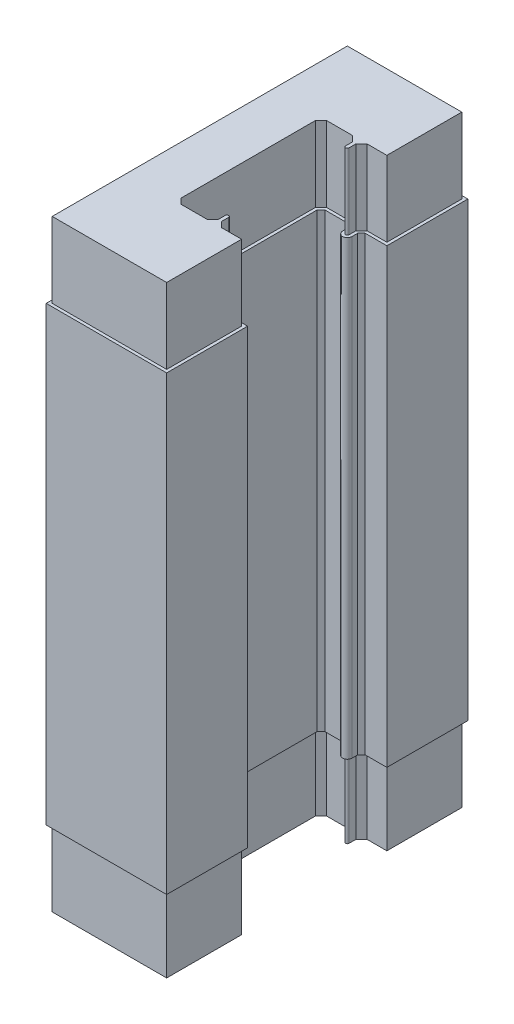
from build123d import *

# Parameters (mm, degrees)
BOSS_EXTRUDE1_DEPTH = 40
CUT_EXTRUDE6_START  = -5
CUT_EXTRUDE6_DEPTH  = 5
CUT_EXTRUDE7_DEPTH  = 5
SKETCH10_R          = 1.5
CUT_EXTRUDE8_DEPTH  = 3
CUT_EXTRUDE4_START  = -5
CUT_EXTRUDE4_DEPTH  = 5
CUT_EXTRUDE5_DEPTH  = 5


with BuildPart() as part:
    # Sketch1 → Boss-Extrude1 (new body)
    with BuildSketch(Plane(origin=(0, 0, 0), x_dir=(1, 0, 0), z_dir=(0, 1, 0))):
        with BuildLine():
            Line((-3.897731109, -10.925164292), (4.102268891, -10.925164292))
            Line((4.102268891, -10.925164292), (4.102268891, -5.550166604))
            Line((4.102268891, -5.550166604), (3.383518531, -5.550166604))
            Line((3.383518531, -5.550166604), (2.664768172, -5.550166604))
            Line((2.664768172, -5.550166604), (2.414768047, -5.300166479))
            Line((2.414768047, -5.300166479), (2.414768047, -4.925166292))
            ThreePointArc((2.414768047, -4.925166292), (2.32323887, -4.704195312), (2.102267891, -4.612666136))
            ThreePointArc((2.102267891, -4.612666136), (1.881296911, -4.704195312), (1.789767734, -4.925166292))
            Line((1.789767734, -4.925166292), (1.789767734, -5.300166479))
            Line((1.789767734, -5.300166479), (1.539767609, -5.550166604))
            Line((1.539767609, -5.550166604), (-0.022733172, -5.550166604))
            Line((-0.022733172, -5.550166604), (-0.272733297, -5.300166479))
            Line((-0.272733297, -5.300166479), (-0.272733297, 3.449837896))
            Line((-0.272733297, 3.449837896), (-0.022733172, 3.699838021))
            Line((-0.022733172, 3.699838021), (1.539767609, 3.699838021))
            Line((1.539767609, 3.699838021), (1.789767734, 3.449837896))
            Line((1.789767734, 3.449837896), (1.789767734, 3.074837708))
            ThreePointArc((1.789767734, 3.074837708), (1.881296911, 2.853866728), (2.102267891, 2.762337552))
            ThreePointArc((2.102267891, 2.762337552), (2.32323887, 2.853866728), (2.414768047, 3.074837708))
            Line((2.414768047, 3.074837708), (2.414768047, 3.449837896))
            Line((2.414768047, 3.449837896), (2.664768172, 3.699838021))
            Line((2.664768172, 3.699838021), (3.383518531, 3.699838021))
            Line((3.383518531, 3.699838021), (4.102268891, 3.699838021))
            Line((4.102268891, 3.699838021), (4.102268891, 9.074835708))
            Line((4.102268891, 9.074835708), (-3.897731109, 9.074835708))
            Line((-3.897731109, 9.074835708), (-3.897731109, -10.925164292))
        make_face()
    extrude(amount=BOSS_EXTRUDE1_DEPTH)

    # Sketch8 → Cut-Extrude6 (cut)
    with BuildSketch(Plane(origin=(0, 40, 0), x_dir=(1, 0, 0), z_dir=(0, 1, 0)).offset(CUT_EXTRUDE6_START)):
        with BuildLine():
            Line((2.414768047, 3.074837708), (2.414768047, 3.449837896))
            Line((2.414768047, 3.449837896), (2.664768172, 3.699838021))
            Line((2.664768172, 3.699838021), (4.102268891, 3.699838021))
            Line((4.102268891, 3.699838021), (4.102268891, 9.074835708))
            Line((4.102268891, 9.074835708), (-3.897731109, 9.074835708))
            Line((-3.897731109, 9.074835708), (-3.897731109, -10.925164292))
            Line((-3.897731109, -10.925164292), (4.102268891, -10.925164292))
            Line((4.102268891, -10.925164292), (4.102268891, -5.550166604))
            Line((4.102268891, -5.550166604), (2.664768172, -5.550166604))
            Line((2.664768172, -5.550166604), (2.414768047, -5.300166479))
            Line((2.414768047, -5.300166479), (2.414768047, -4.925166292))
            ThreePointArc((2.414768047, -4.925166292), (2.102267891, -4.612666136), (1.789767734, -4.925166292))
            Line((1.789767734, -4.925166292), (1.789767734, -5.300166479))
            Line((1.789767734, -5.300166479), (1.539767609, -5.550166604))
            Line((1.539767609, -5.550166604), (-0.022733172, -5.550166604))
            Line((-0.022733172, -5.550166604), (-0.272733297, -5.300166479))
            Line((-0.272733297, -5.300166479), (-0.272733297, 3.449837896))
            Line((-0.272733297, 3.449837896), (-0.022733172, 3.699838021))
            Line((-0.022733172, 3.699838021), (1.539767609, 3.699838021))
            Line((1.539767609, 3.699838021), (1.789767734, 3.449837896))
            Line((1.789767734, 3.449837896), (1.789767734, 3.074837708))
            ThreePointArc((1.789767734, 3.074837708), (2.102267891, 2.762337552), (2.414768047, 3.074837708))
        make_face()
        with BuildLine():
            Line((2.314768047, 3.074837708), (2.314768047, 3.491259252))
            Line((2.314768047, 3.491259252), (2.623346816, 3.799838021))
            Line((2.623346816, 3.799838021), (4.002268891, 3.799838021))
            Line((4.002268891, 3.799838021), (4.002268891, 8.974835708))
            Line((4.002268891, 8.974835708), (-3.797731109, 8.974835708))
            Line((-3.797731109, 8.974835708), (-3.797731109, -10.825164292))
            Line((-3.797731109, -10.825164292), (4.002268891, -10.825164292))
            Line((4.002268891, -10.825164292), (4.002268891, -5.650166604))
            Line((4.002268891, -5.650166604), (2.623346816, -5.650166604))
            Line((2.623346816, -5.650166604), (2.314768047, -5.341587836))
            Line((2.314768047, -5.341587836), (2.314768047, -4.925166292))
            ThreePointArc((2.314768047, -4.925166292), (2.102267891, -4.712666136), (1.889767734, -4.925166292))
            Line((1.889767734, -4.925166292), (1.889767734, -5.341587836))
            Line((1.889767734, -5.341587836), (1.581188966, -5.650166604))
            Line((1.581188966, -5.650166604), (-0.064154528, -5.650166604))
            Line((-0.064154528, -5.650166604), (-0.372733297, -5.341587836))
            Line((-0.372733297, -5.341587836), (-0.372733297, 3.491259252))
            Line((-0.372733297, 3.491259252), (-0.064154528, 3.799838021))
            Line((-0.064154528, 3.799838021), (1.581188966, 3.799838021))
            Line((1.581188966, 3.799838021), (1.889767734, 3.491259252))
            Line((1.889767734, 3.491259252), (1.889767734, 3.074837708))
            ThreePointArc((1.889767734, 3.074837708), (2.102267891, 2.862337552), (2.314768047, 3.074837708))
        make_face(mode=Mode.SUBTRACT)
    extrude(amount=CUT_EXTRUDE6_DEPTH, mode=Mode.SUBTRACT)

    # Sketch9 → Cut-Extrude7 (cut)
    with BuildSketch(Plane.XZ):
        with BuildLine():
            Line((1.789767734, -3.074837708), (1.789767734, -3.449837896))
            Line((1.789767734, -3.449837896), (1.539767609, -3.699838021))
            Line((1.539767609, -3.699838021), (-0.022733172, -3.699838021))
            Line((-0.022733172, -3.699838021), (-0.272733297, -3.449837896))
            Line((-0.272733297, -3.449837896), (-0.272733297, 5.300166479))
            Line((-0.272733297, 5.300166479), (-0.022733172, 5.550166604))
            Line((-0.022733172, 5.550166604), (1.539767609, 5.550166604))
            Line((1.539767609, 5.550166604), (1.789767734, 5.300166479))
            Line((1.789767734, 5.300166479), (1.789767734, 4.925166292))
            ThreePointArc((1.789767734, 4.925166292), (2.102267891, 4.612666136), (2.414768047, 4.925166292))
            Line((2.414768047, 4.925166292), (2.414768047, 5.300166479))
            Line((2.414768047, 5.300166479), (2.664768172, 5.550166604))
            Line((2.664768172, 5.550166604), (4.102268891, 5.550166604))
            Line((4.102268891, 5.550166604), (4.102268891, 10.925164292))
            Line((4.102268891, 10.925164292), (-3.897731109, 10.925164292))
            Line((-3.897731109, 10.925164292), (-3.897731109, -9.074835708))
            Line((-3.897731109, -9.074835708), (4.102268891, -9.074835708))
            Line((4.102268891, -9.074835708), (4.102268891, -3.699838021))
            Line((4.102268891, -3.699838021), (2.664768172, -3.699838021))
            Line((2.664768172, -3.699838021), (2.414768047, -3.449837896))
            Line((2.414768047, -3.449837896), (2.414768047, -3.074837708))
            ThreePointArc((2.414768047, -3.074837708), (2.102267891, -2.762337552), (1.789767734, -3.074837708))
        make_face()
        with BuildLine():
            Line((1.889767734, -3.074837708), (1.889767734, -3.491259252))
            Line((1.889767734, -3.491259252), (1.581188966, -3.799838021))
            Line((1.581188966, -3.799838021), (-0.064154528, -3.799838021))
            Line((-0.064154528, -3.799838021), (-0.372733297, -3.491259252))
            Line((-0.372733297, -3.491259252), (-0.372733297, 5.341587836))
            Line((-0.372733297, 5.341587836), (-0.064154528, 5.650166604))
            Line((-0.064154528, 5.650166604), (1.581188966, 5.650166604))
            Line((1.581188966, 5.650166604), (1.889767734, 5.341587836))
            Line((1.889767734, 5.341587836), (1.889767734, 4.925166292))
            ThreePointArc((1.889767734, 4.925166292), (2.102267891, 4.712666136), (2.314768047, 4.925166292))
            Line((2.314768047, 4.925166292), (2.314768047, 5.341587836))
            Line((2.314768047, 5.341587836), (2.623346816, 5.650166604))
            Line((2.623346816, 5.650166604), (4.002268891, 5.650166604))
            Line((4.002268891, 5.650166604), (4.002268891, 10.825164292))
            Line((4.002268891, 10.825164292), (-3.797731109, 10.825164292))
            Line((-3.797731109, 10.825164292), (-3.797731109, -8.974835708))
            Line((-3.797731109, -8.974835708), (4.002268891, -8.974835708))
            Line((4.002268891, -8.974835708), (4.002268891, -3.799838021))
            Line((4.002268891, -3.799838021), (2.623346816, -3.799838021))
            Line((2.623346816, -3.799838021), (2.314768047, -3.491259252))
            Line((2.314768047, -3.491259252), (2.314768047, -3.074837708))
            ThreePointArc((2.314768047, -3.074837708), (2.102267891, -2.862337552), (1.889767734, -3.074837708))
        make_face(mode=Mode.SUBTRACT)
    extrude(amount=-CUT_EXTRUDE7_DEPTH, mode=Mode.SUBTRACT)

    # Sketch10 → Cut-Extrude8 (cut)
    with BuildSketch(Plane.ZY.offset(3.897731109)):
        with Locations((-6.574835708, 28)):
            Circle(SKETCH10_R)
        with Locations((8.425164292, 28)):
            Circle(SKETCH10_R)
        with Locations((8.425164292, 12)):
            Circle(SKETCH10_R)
        with Locations((-6.574835708, 12)):
            Circle(SKETCH10_R)
    extrude(amount=-CUT_EXTRUDE8_DEPTH, mode=Mode.SUBTRACT)

    # Sketch5 → Cut-Extrude4 (cut)
    with BuildSketch(Plane(origin=(0, 40, 0), x_dir=(1, 0, 0), z_dir=(0, 1, 0)).offset(CUT_EXTRUDE4_START)):
        with BuildLine():
            Line((1.889767734, 3.491259252), (1.889767734, 3.074837708))
            ThreePointArc((1.889767734, 3.074837708), (2.102267891, 2.862337552), (2.314768047, 3.074837708))
            Line((2.314768047, 3.074837708), (2.314768047, 3.491259252))
            Line((2.314768047, 3.491259252), (2.623346816, 3.799838021))
            Line((2.623346816, 3.799838021), (4.002268891, 3.799838021))
            Line((4.002268891, 3.799838021), (4.002268891, 8.974835708))
            Line((4.002268891, 8.974835708), (-3.797731109, 8.974835708))
            Line((-3.797731109, 8.974835708), (-3.797731109, -10.825164292))
            Line((-3.797731109, -10.825164292), (4.002268891, -10.825164292))
            Line((4.002268891, -10.825164292), (4.002268891, -5.650166604))
            Line((4.002268891, -5.650166604), (2.623346816, -5.650166604))
            Line((2.623346816, -5.650166604), (2.314768047, -5.341587836))
            Line((2.314768047, -5.341587836), (2.314768047, -4.925166292))
            ThreePointArc((2.314768047, -4.925166292), (2.102267891, -4.712666136), (1.889767734, -4.925166292))
            Line((1.889767734, -4.925166292), (1.889767734, -5.341587836))
            Line((1.889767734, -5.341587836), (1.581188966, -5.650166604))
            Line((1.581188966, -5.650166604), (-0.064154528, -5.650166604))
            Line((-0.064154528, -5.650166604), (-0.372733297, -5.341587836))
            Line((-0.372733297, -5.341587836), (-0.372733297, 3.491259252))
            Line((-0.372733297, 3.491259252), (-0.064154528, 3.799838021))
            Line((-0.064154528, 3.799838021), (1.581188966, 3.799838021))
            Line((1.581188966, 3.799838021), (1.889767734, 3.491259252))
        make_face()
        with BuildLine():
            Line((1.989767734, 3.532680608), (1.989767734, 3.074837708))
            ThreePointArc((1.989767734, 3.074837708), (2.102267891, 2.962337552), (2.214768047, 3.074837708))
            Line((2.214768047, 3.074837708), (2.214768047, 3.532680608))
            Line((2.214768047, 3.532680608), (2.581925459, 3.899838021))
            Line((2.581925459, 3.899838021), (3.902268891, 3.899838021))
            Line((3.902268891, 3.899838021), (3.902268891, 8.874835708))
            Line((3.902268891, 8.874835708), (-3.697731109, 8.874835708))
            Line((-3.697731109, 8.874835708), (-3.697731109, -10.725164292))
            Line((-3.697731109, -10.725164292), (3.902268891, -10.725164292))
            Line((3.902268891, -10.725164292), (3.902268891, -5.750166604))
            Line((3.902268891, -5.750166604), (2.581925459, -5.750166604))
            Line((2.581925459, -5.750166604), (2.214768047, -5.383009192))
            Line((2.214768047, -5.383009192), (2.214768047, -4.925166292))
            ThreePointArc((2.214768047, -4.925166292), (2.102267891, -4.812666136), (1.989767734, -4.925166292))
            Line((1.989767734, -4.925166292), (1.989767734, -5.383009192))
            Line((1.989767734, -5.383009192), (1.622610322, -5.750166604))
            Line((1.622610322, -5.750166604), (-0.105575884, -5.750166604))
            Line((-0.105575884, -5.750166604), (-0.472733297, -5.383009192))
            Line((-0.472733297, -5.383009192), (-0.472733297, 3.532680608))
            Line((-0.472733297, 3.532680608), (-0.105575884, 3.899838021))
            Line((-0.105575884, 3.899838021), (1.622610322, 3.899838021))
            Line((1.622610322, 3.899838021), (1.989767734, 3.532680608))
        make_face(mode=Mode.SUBTRACT)
    extrude(amount=CUT_EXTRUDE4_DEPTH, mode=Mode.SUBTRACT)

    # Sketch6 → Cut-Extrude5 (cut)
    with BuildSketch(Plane.XZ):
        with BuildLine():
            Line((1.889767734, -3.491259252), (1.581188966, -3.799838021))
            Line((1.581188966, -3.799838021), (-0.064154528, -3.799838021))
            Line((-0.064154528, -3.799838021), (-0.372733297, -3.491259252))
            Line((-0.372733297, -3.491259252), (-0.372733297, 5.341587836))
            Line((-0.372733297, 5.341587836), (-0.064154528, 5.650166604))
            Line((-0.064154528, 5.650166604), (1.581188966, 5.650166604))
            Line((1.581188966, 5.650166604), (1.889767734, 5.341587836))
            Line((1.889767734, 5.341587836), (1.889767734, 4.925166292))
            ThreePointArc((1.889767734, 4.925166292), (2.102267891, 4.712666136), (2.314768047, 4.925166292))
            Line((2.314768047, 4.925166292), (2.314768047, 5.341587836))
            Line((2.314768047, 5.341587836), (2.623346816, 5.650166604))
            Line((2.623346816, 5.650166604), (4.002268891, 5.650166604))
            Line((4.002268891, 5.650166604), (4.002268891, 10.825164292))
            Line((4.002268891, 10.825164292), (-3.797731109, 10.825164292))
            Line((-3.797731109, 10.825164292), (-3.797731109, -8.974835708))
            Line((-3.797731109, -8.974835708), (4.002268891, -8.974835708))
            Line((4.002268891, -8.974835708), (4.002268891, -3.799838021))
            Line((4.002268891, -3.799838021), (2.623346816, -3.799838021))
            Line((2.623346816, -3.799838021), (2.314768047, -3.491259252))
            Line((2.314768047, -3.491259252), (2.314768047, -3.074837708))
            ThreePointArc((2.314768047, -3.074837708), (2.102267891, -2.862337552), (1.889767734, -3.074837708))
            Line((1.889767734, -3.074837708), (1.889767734, -3.491259252))
        make_face()
        with BuildLine():
            Line((1.622610322, -3.899838021), (-0.105575884, -3.899838021))
            Line((-0.105575884, -3.899838021), (-0.472733297, -3.532680608))
            Line((-0.472733297, -3.532680608), (-0.472733297, 5.383009192))
            Line((-0.472733297, 5.383009192), (-0.105575884, 5.750166604))
            Line((-0.105575884, 5.750166604), (1.622610322, 5.750166604))
            Line((1.622610322, 5.750166604), (1.989767734, 5.383009192))
            Line((1.989767734, 5.383009192), (1.989767734, 4.925166292))
            ThreePointArc((1.989767734, 4.925166292), (2.102267891, 4.812666136), (2.214768047, 4.925166292))
            Line((2.214768047, 4.925166292), (2.214768047, 5.383009192))
            Line((2.214768047, 5.383009192), (2.581925459, 5.750166604))
            Line((2.581925459, 5.750166604), (3.902268891, 5.750166604))
            Line((3.902268891, 5.750166604), (3.902268891, 10.725164292))
            Line((3.902268891, 10.725164292), (-3.697731109, 10.725164292))
            Line((-3.697731109, 10.725164292), (-3.697731109, -8.874835708))
            Line((-3.697731109, -8.874835708), (3.902268891, -8.874835708))
            Line((3.902268891, -8.874835708), (3.902268891, -3.899838021))
            Line((3.902268891, -3.899838021), (2.581925459, -3.899838021))
            Line((2.581925459, -3.899838021), (2.214768047, -3.532680608))
            Line((2.214768047, -3.532680608), (2.214768047, -3.074837708))
            ThreePointArc((2.214768047, -3.074837708), (2.102267891, -2.962337552), (1.989767734, -3.074837708))
            Line((1.989767734, -3.074837708), (1.989767734, -3.532680608))
            Line((1.989767734, -3.532680608), (1.622610322, -3.899838021))
        make_face(mode=Mode.SUBTRACT)
    extrude(amount=-CUT_EXTRUDE5_DEPTH, mode=Mode.SUBTRACT)


solid = part.part
